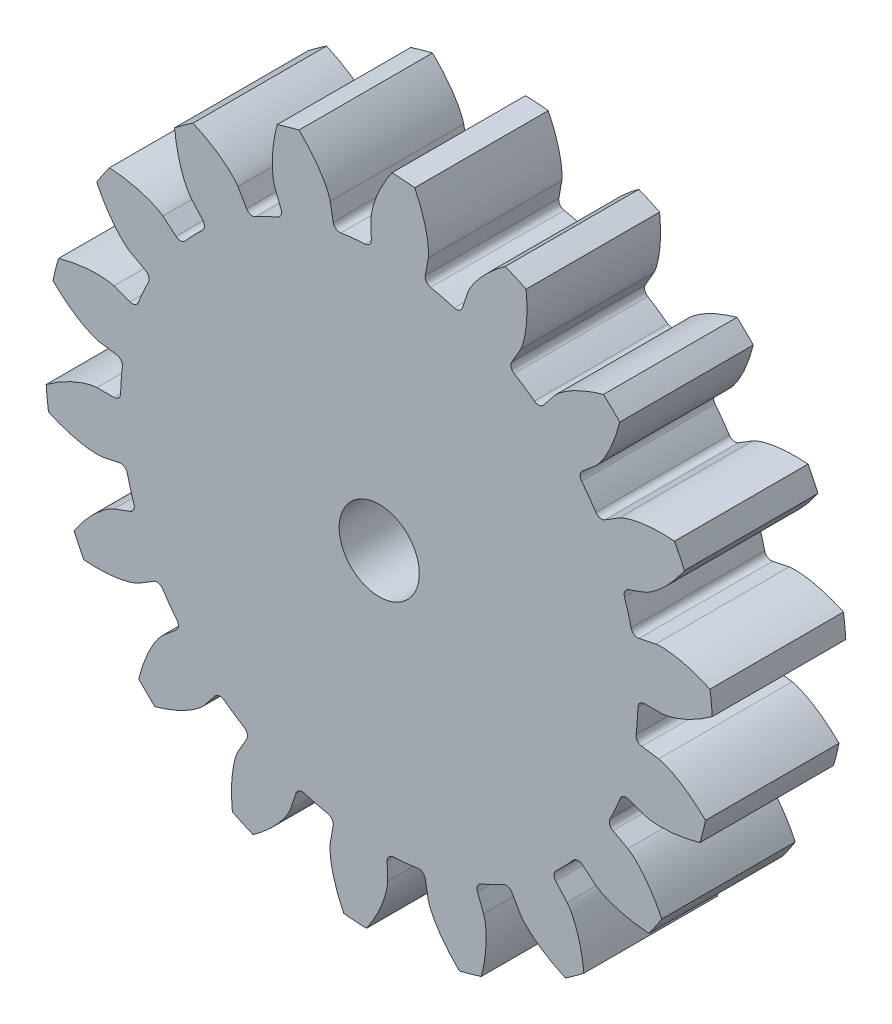
from build123d import *

# Parameters (mm, degrees)
SKETCH1_R           = 25
BOSS_EXTRUDE1_DEPTH = 10
CUT_EXTRUDE1_DEPTH  = 37.742346142
CIRPATTERN6_COUNT   = 18
SKETCH3_R           = 3
CUT_EXTRUDE2_DEPTH  = 10


with BuildPart() as part:
    # Sketch1 → Boss-Extrude1 (new body)
    with BuildSketch(Plane.XY):
        Circle(SKETCH1_R)
    extrude(amount=BOSS_EXTRUDE1_DEPTH)

    # Sketch2 → Cut-Extrude1 (cut, symmetric)
    with BuildSketch(Plane.XY.offset(10)):
        with BuildLine():
            Line((21.143083968, 0), (19.868709696, 0))
            ThreePointArc((19.868709696, 0), (19.519631846, -0.14202702), (19.368867943, -0.487421384))
            ThreePointArc((19.368867943, -0.487421384), (19.324295761, -1.400792041), (19.236676135, -2.311042247))
            ThreePointArc((19.236676135, -2.311042247), (19.336051316, -2.674568853), (19.660996749, -2.865454909))
            Line((19.660996749, -2.865454909), (20.922048362, -3.049244499))
            add(Edge.make_bspline(
                [(20.922048362, -3.049244499), (20.929185648, -3.050389794), (20.949152481, -3.053919981), (20.986690391, -3.061848298), (21.047600983, -3.076559), (21.124675267, -3.097902402), (21.223617576, -3.128459856), (21.339243222, -3.168261873), (21.465263801, -3.215968378), (21.601160271, -3.272125384), (21.735608747, -3.331892733), (21.868622397, -3.394976255), (22.000091953, -3.460927725), (22.158064086, -3.54446664), (22.345670769, -3.649698408), (22.562152878, -3.779998874), (22.804252488, -3.936342559), (23.047122701, -4.104725359), (23.282857541, -4.277810029), (23.517102021, -4.461069893), (23.740943837, -4.644315913), (23.969181937, -4.8430808), (24.161482762, -5.016245365), (24.313800482, -5.161608469), (24.401072045, -5.246121384), (24.436014815, -5.280263248)],
                knots=[0, 0, 0, 0, 0, 0.005376749, 0.015083688, 0.02853182, 0.04661014, 0.064854849, 0.092110525, 0.119476176, 0.146842496, 0.174208854, 0.201574956, 0.228941013, 0.256307345, 0.307035032, 0.361767352, 0.416499661, 0.471231937, 0.525964282, 0.580696616, 0.635428982, 0.690161387, 0.744893688, 0.782595304, 0.782595304, 0.782595304, 0.782595304, 0.782595304], degree=4))
            ThreePointArc((24.436014815, -5.280263248), (24.858603846, -2.655148737), (25, 0))
            ThreePointArc((25, 0), (24.985513504, 0.850949423), (24.942070806, 1.700912664))
            add(Edge.make_bspline(
                [(21.143083968, 0), (21.150311813, 0.000103986), (21.170579029, 0.000717661), (21.208867925, 0.003149395), (21.27126331, 0.008921814), (21.350609973, 0.018926474), (21.452924892, 0.034895063), (21.573081982, 0.057605509), (21.704665315, 0.086638655), (21.847240019, 0.122609663), (21.98890255, 0.162362098), (22.129623511, 0.205602969), (22.269230134, 0.251904494), (22.437598722, 0.311787411), (22.638420584, 0.38886252), (22.871431395, 0.486579853), (23.133547833, 0.606373599), (23.398163093, 0.737969464), (23.656395677, 0.875247104), (23.914620942, 1.022808504), (24.1625503, 1.171856469), (24.417068103, 1.335627034), (24.632332266, 1.479247765), (24.804021806, 1.601124022), (24.902569416, 1.672167157), (24.942070806, 1.700912664)],
                knots=[0, 0, 0, 0, 0, 0.005376749, 0.015083688, 0.02853182, 0.04661014, 0.064854849, 0.092110525, 0.119476176, 0.146842496, 0.174208854, 0.201574956, 0.228941013, 0.256307345, 0.307035032, 0.361767352, 0.416499661, 0.471231937, 0.525964282, 0.580696616, 0.635428982, 0.690161387, 0.744893688, 0.782595304, 0.782595304, 0.782595304, 0.782595304, 0.782595304], degree=4))
        make_face()
    cut_extrude1 = extrude(amount=CUT_EXTRUDE1_DEPTH, both=True, mode=Mode.SUBTRACT)

    # CirPattern6: Cut-Extrude1 ×18 about axis
    cirpattern6_axis = Axis((0, 0, 10), (0, 0, -1))
    for i in range(1, CIRPATTERN6_COUNT):
        add(cut_extrude1.rotate(cirpattern6_axis, i * 360 / CIRPATTERN6_COUNT), mode=Mode.SUBTRACT)

    # Sketch3 → Cut-Extrude2 (cut)
    with BuildSketch(Plane.XY.offset(10)):
        Circle(SKETCH3_R)
    extrude(amount=-CUT_EXTRUDE2_DEPTH, mode=Mode.SUBTRACT)


solid = part.part
